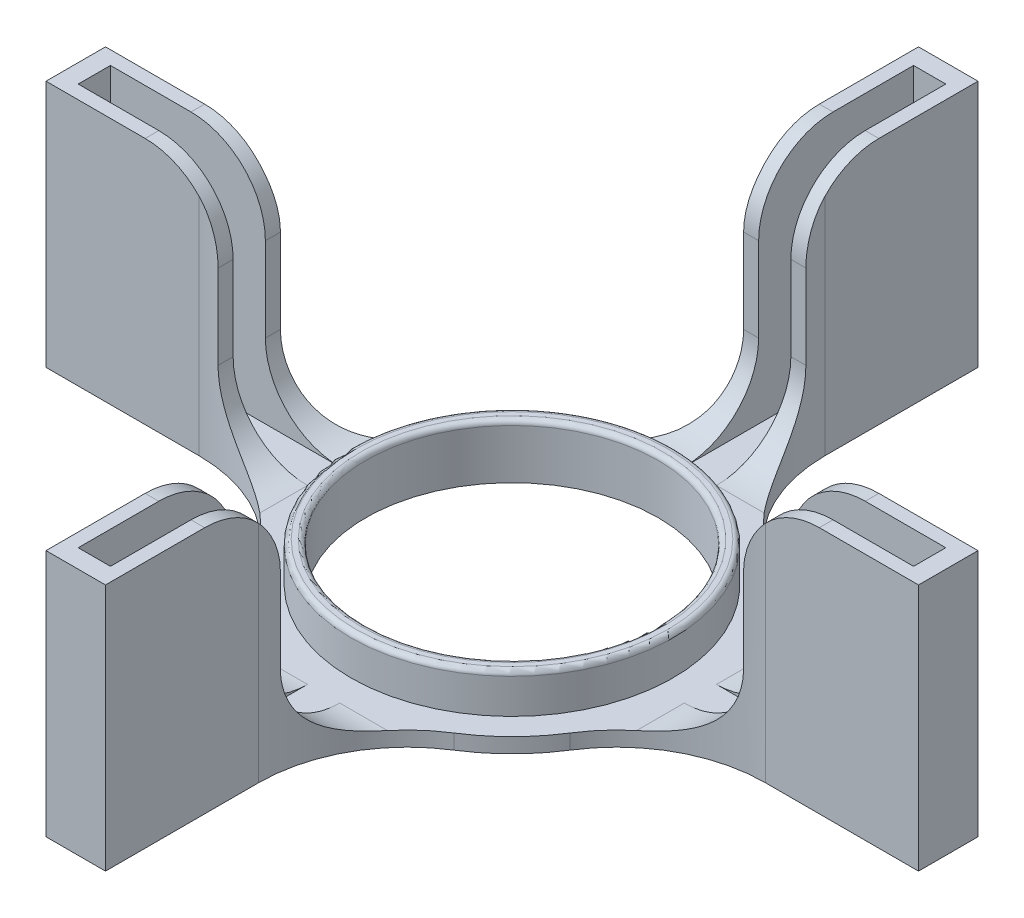
from build123d import *

# Parameters (mm, degrees)
SKETCH1_R                = 37.5
BASE_DEPTH               = 3
SKETCH2_W                = 12
SKETCH2_H                = 88
FIN_EXTENSION_BASE_DEPTH = 3
FIN_CRADDLE_DEPTH        = 50
FILLET2_R                = 30
FILLET1_R                = 15
CIRPATTERN1_COUNT        = 4
FILLET2_OF_CIRPATTERN1_R = 30
FILLET1_OF_CIRPATTERN1_R = 15
BOSS_EXTRUDE5_REACH      = 132.419
SKETCH4_R                = 32.5
SKETCH4_R_2              = 29.5
FILLET3_R                = 5
FILLET4_R                = 1
SKETCH5_R                = 29.5
CUT_EXTRUDE1_DEPTH       = 135.119349872


with BuildPart() as part:
    # Sketch1 → BASE (new body)
    with BuildSketch(Plane(origin=(0, 0, 0), x_dir=(1, 0, 0), z_dir=(0, 1, 0))):
        with Locations(Location((0, 0, 0), (0, 0, 270))):
            Circle(SKETCH1_R)
    extrude(amount=BASE_DEPTH)

    # Sketch2 → FIN EXTENSION BASE (add)
    with BuildSketch(Plane(origin=(0, 0, 0), x_dir=(1, 0, 0), z_dir=(0, 1, 0))):
        with Locations((0, 44)):
            Rectangle(SKETCH2_W, SKETCH2_H)
    fin_extension_base = extrude(amount=FIN_EXTENSION_BASE_DEPTH)

    # Sketch3 → FIN CRADDLE (add)
    with BuildSketch(Plane(origin=(0, 0, 0), x_dir=(1, 0, 0), z_dir=(0, 1, 0))):
        Polygon((-6, 53), (-3.25, 53), (-3.25, 84.25), (3.25, 84.25), (3.25, 53), (6, 53), (6, 88), (-6, 88), align=None)
    fin_craddle = extrude(amount=FIN_CRADDLE_DEPTH)

    # Fillet2
    fillet2_edges = [part.edges().sort_by_distance(p)[0] for p in [
        (6, 1.5, -37.016888038),
        (-6, 1.5, -37.016888038),
    ]]
    fillet(fillet2_edges, radius=FILLET2_R)

    # Fillet1
    fillet1_edges = [part.edges().sort_by_distance(p)[0] for p in [
        (-4.765646996, 50, -53),
        (4.765646996, 50, -53),
        (-4.765646996, 3, -53),
        (4.765646996, 3, -53),
    ]]
    fillet(fillet1_edges, radius=FILLET1_R)

    # CirPattern1: FIN EXTENSION BASE, FIN CRADDLE ×4 about axis
    cirpattern1_axis = Axis((0, 0, 0), (0, 1, 0))
    add([fin_extension_base.rotate(cirpattern1_axis, i * 360 / CIRPATTERN1_COUNT) for i in range(1, CIRPATTERN1_COUNT)])
    add([fin_craddle.rotate(cirpattern1_axis, i * 360 / CIRPATTERN1_COUNT) for i in range(1, CIRPATTERN1_COUNT)])

    # Fillet2 of CirPattern1
    fillet2_of_cirpattern1_edges = [part.edges().sort_by_distance(p)[0] for p in [
        (-37.016888038, 1.5, -6),
        (-37.016888038, 1.5, 6),
        (-6, 1.5, 37.016888038),
        (6, 1.5, 37.016888038),
        (37.016888038, 1.5, 6),
        (37.016888038, 1.5, -6),
    ]]
    fillet(fillet2_of_cirpattern1_edges, radius=FILLET2_OF_CIRPATTERN1_R)

    # Fillet1 of CirPattern1
    fillet1_of_cirpattern1_edges = [part.edges().sort_by_distance(p)[0] for p in [
        (-53, 50, 4.765646996),
        (-53, 50, -4.765646996),
        (-53, 3, 4.765646996),
        (-53, 3, -4.765646996),
        (4.765646996, 50, 53),
        (-4.765646996, 50, 53),
        (4.765646996, 3, 53),
        (-4.765646996, 3, 53),
        (53, 50, -4.765646996),
        (53, 50, 4.765646996),
        (53, 3, -4.765646996),
        (53, 3, 4.765646996),
    ]]
    fillet(fillet1_of_cirpattern1_edges, radius=FILLET1_OF_CIRPATTERN1_R)

    # Sketch4 → Boss-Extrude5 (add, up to next)
    with BuildSketch(Plane(origin=(0, 11, 0), x_dir=(1, 0, 0), z_dir=(0, 1, 0)), mode=Mode.PRIVATE) as boss_extrude5_sk1:
        with Locations(Location((0, 0, 0), (0, 0, 270))):
            Circle(SKETCH4_R)
        with Locations(Location((0, 0, 0), (0, 0, 270))):
            Circle(SKETCH4_R_2, mode=Mode.SUBTRACT)
    boss_extrude5_tool1 = extrude(boss_extrude5_sk1.sketch, amount=-BOSS_EXTRUDE5_REACH, mode=Mode.PRIVATE) - part.part
    add(boss_extrude5_tool1.solids().sort_by_distance((0, 11, -31.580761))[0])

    # Fillet3
    fillet3_edges = [part.edges().sort_by_distance(p)[0] for p in [
        (0, 3, -29.5),
    ]]
    fillet(fillet3_edges, radius=FILLET3_R)

    # Fillet4
    fillet4_edges = [part.edges().sort_by_distance(p)[0] for p in [
        (0, 11, -32.5),
        (0, 11, -29.5),
    ]]
    fillet(fillet4_edges, radius=FILLET4_R)

    # Sketch5 → Cut-Extrude1 (cut, through all)
    with BuildSketch(Plane(origin=(0, 0, 0), x_dir=(1, 0, 0), z_dir=(0, 1, 0))):
        with Locations(Location((0, 0, 0), (0, 0, 270))):
            Circle(SKETCH5_R)
    extrude(amount=CUT_EXTRUDE1_DEPTH, mode=Mode.SUBTRACT)


solid = part.part
